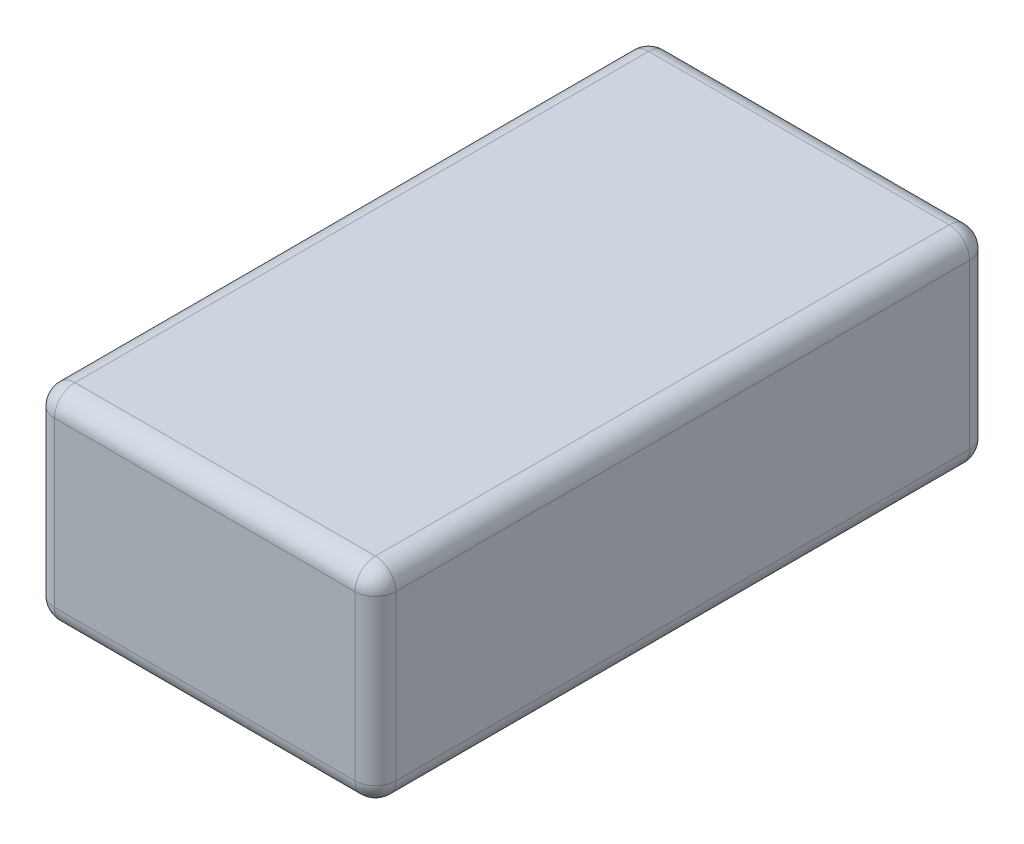
from build123d import *

# Parameters (mm, degrees)
SKETCH1_W           = 25
SKETCH1_H           = 45
BOSS_EXTRUDE1_DEPTH = 15
FILLET1_R           = 1.5


with BuildPart() as part:
    # Sketch1 → Boss-Extrude1 (new body)
    with BuildSketch(Plane(origin=(0, 3, 0), x_dir=(1, 0, 0), z_dir=(0, 1, 0))):
        with Locations((-24.13789371, 0.442641975)):
            Rectangle(SKETCH1_W, SKETCH1_H)
    extrude(amount=BOSS_EXTRUDE1_DEPTH)

    # Fillet1
    fillet1_edges = [part.edges().sort_by_distance(p)[0] for p in [
        (-11.63789371, 18, -0.442641975),
        (-24.13789371, 18, -22.942641975),
        (-36.63789371, 18, -0.442641975),
        (-24.13789371, 3, -22.942641975),
        (-11.63789371, 3, -0.442641975),
        (-24.13789371, 3, 22.057358025),
        (-36.63789371, 3, -0.442641975),
        (-36.63789371, 10.5, -22.942641975),
        (-11.63789371, 10.5, -22.942641975),
        (-11.63789371, 10.5, 22.057358025),
        (-36.63789371, 10.5, 22.057358025),
        (-24.13789371, 18, 22.057358025),
    ]]
    fillet(fillet1_edges, radius=FILLET1_R)


solid = part.part
